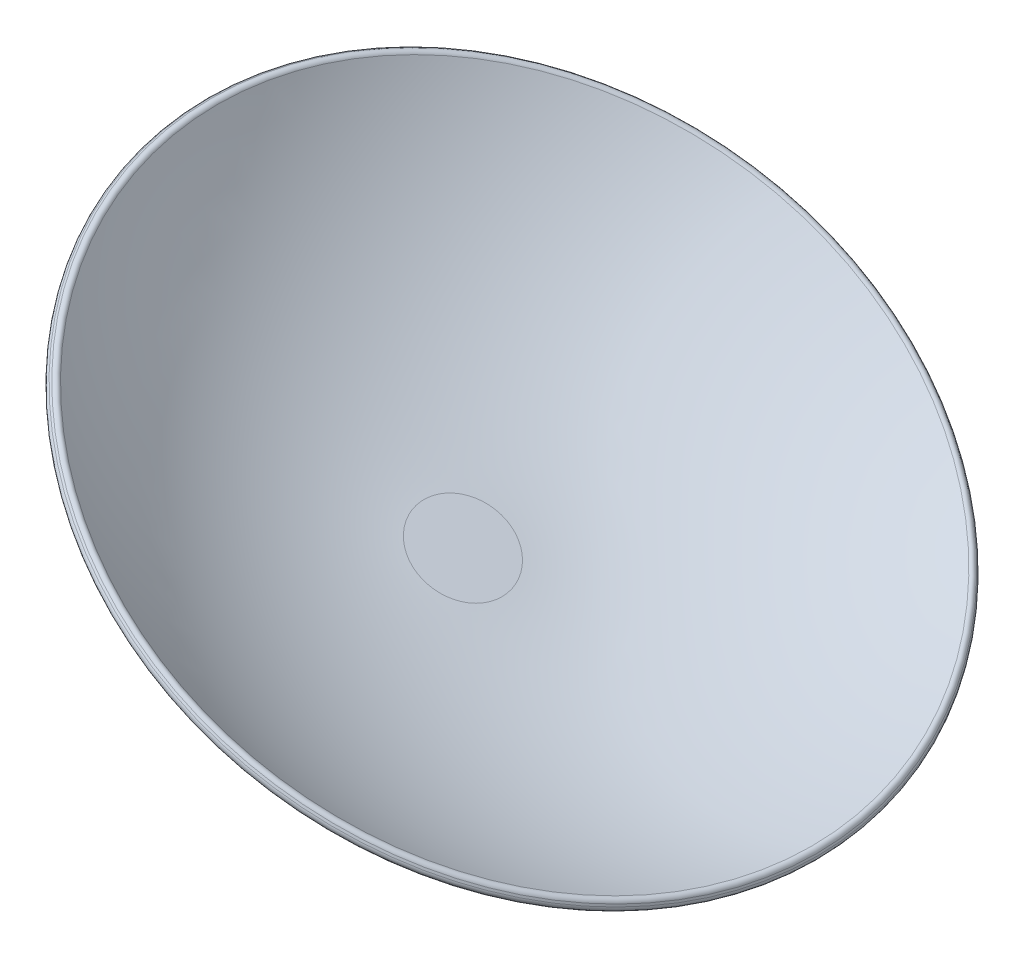
from build123d import *

# Parameters (mm, degrees)
SWEEP1_PROFILE_R = 6.35
FILLET2_R        = 5.08


with BuildPart() as part:
    # Sketch1 → Revolve1 (revolve)
    with BuildSketch(Plane.XY):
        with BuildLine():
            Line((0, 28.575), (0, -28.575))
            ThreePointArc((0, -28.575), (-28.575, 0), (0, 28.575))
        make_face()
    revolve(axis=Axis((0, 28.575, 0), (0, -1, 0)))

    # Sweep1: sweep along a path in Sketch3
    with BuildLine(Plane.XY) as sweep1_path:
        Line((0, 0), (29.329393675, 50.8))
    # Sweep1 profile (on start of the path) → Sweep1 (sweep)
    with BuildSketch(Plane(origin=(0, 0, 0), x_dir=(0.8660254037844399, -0.4999999999999978, 0), z_dir=(0.4999999999999978, 0.8660254037844399, 0))):
        Circle(SWEEP1_PROFILE_R)
    sweep(path=sweep1_path.line)

    # Sketch48 → Revolve4 (revolve)
    with BuildSketch(Plane.XY):
        with BuildLine():
            Line((29.329393675, 50.8), (73.246601158, 25.267297697))
            ThreePointArc((73.246601158, 25.267297697), (248.565164439, -40.386076535), (435.729393675, -44.45))
            Line((435.729393675, -44.45), (433.874323966, -31.886214091))
            ThreePointArc((433.874323966, -31.886214091), (250.963827213, -27.914652523), (79.629776734, 36.246599568))
            Line((79.629776734, 36.246599568), (35.712569251, 61.779301871))
            Line((35.712569251, 61.779301871), (29.329393675, 50.8))
        make_face()
    revolve(axis=Axis((29.329393675, 50.8, 0), (0.5026122500572271, 0.8645119583281723, 0)))

    # Fillet2
    fillet2_edges = [part.edges().sort_by_distance(p)[0] for p in [
        (-254.516797313, 356.847157088, 0),
        (-242.680690294, 361.451130441, 0),
    ]]
    fillet(fillet2_edges, radius=FILLET2_R)


solid = part.part
